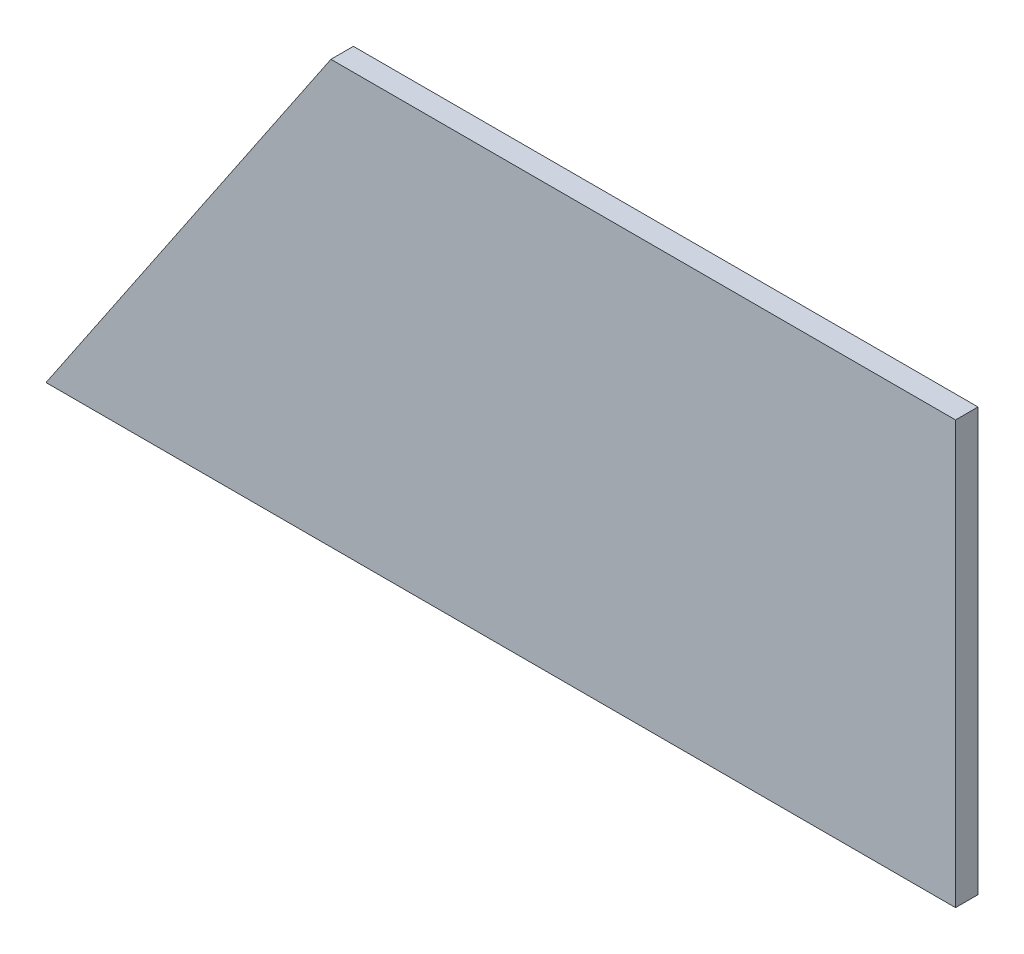
from build123d import *

# Parameters (mm, degrees)
BOSS_EXTRUDE1_DEPTH = 25.4


with BuildPart() as part:
    # Sketch1 → Boss-Extrude1 (new body)
    with BuildSketch(Plane.XY):
        Polygon((0, 0), (322.091306963, 477.52), (1028.211306963, 477.52), (1028.211306963, 0), align=None)
    extrude(amount=BOSS_EXTRUDE1_DEPTH)


solid = part.part
